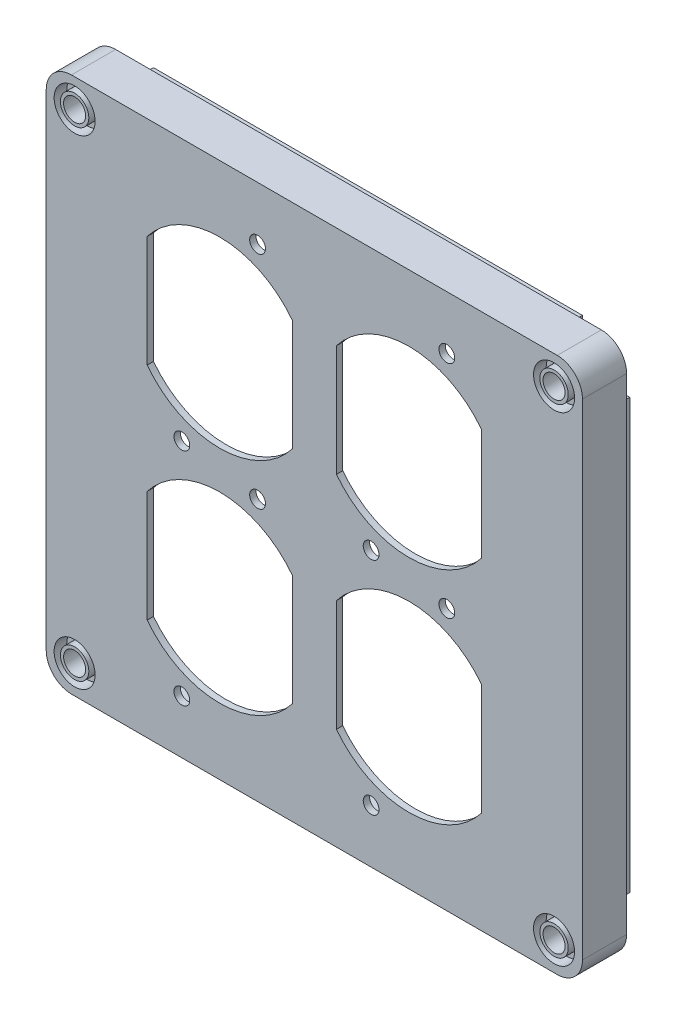
from build123d import *

# Parameters (mm, degrees)
SKETCH1_W                 = 85
SKETCH1_H                 = 85
BOSS_EXTRUDE1_DEPTH       = 7
CUT_EXTRUDE4_DEPTH        = 6
FILLET4_R                 = 4
CUT_EXTRUDE1_DEPTH        = 61.510329697
SKETCH3_R                 = 1.25
CUT_EXTRUDE6_DEPTH        = 61.510329697
LPATTERN1_COUNT           = 2
LPATTERN1_PITCH           = 35
LPATTERN1_COUNT_DIR2      = 2
LPATTERN1_PITCH_DIR2      = 30
BOSS_EXTRUDE6_DEPTH       = 7
SKETCH15_R                = 1.75
CUT_EXTRUDE7_DEPTH        = 61.510329697
SKETCH30_R                = 3.25
CUT_EXTRUDE8_DEPTH        = 2
SKETCH31_R                = 2.25
SKETCH31_R_2              = 1.75
EXTRUDE_THIN2_DEPTH       = 2
MIRROR4_COPY_1_DEPTH      = 7
MIRROR4_COPY_2_SKETCH_R   = 1.75
MIRROR4_COPY_2_DEPTH      = 61.510329697
MIRROR4_COPY_3_SKETCH_R   = 3.25
MIRROR4_COPY_3_DEPTH      = 2
MIRROR4_COPY_4_SKETCH_R   = 2.25
MIRROR4_COPY_4_SKETCH_R_2 = 1.75
MIRROR4_COPY_4_DEPTH      = 2
MOVE_FACE1_BY             = 0.5
MOVE_FACE1_2_BY           = 0.5
MOVE_FACE1_3_BY           = 0.5
MOVE_FACE1_4_BY           = 0.5
MOVE_FACE1_5_BY           = 0.5
MOVE_FACE1_6_BY           = 0.5
MOVE_FACE1_7_BY           = 0.5
MOVE_FACE1_8_BY           = 0.5
MOVE_FACE1_9_BY           = 0.5
MOVE_FACE1_10_BY          = 0.5
MOVE_FACE1_11_BY          = 0.5
MOVE_FACE1_12_BY          = 0.5
EXTRUDE_THIN1_DEPTH       = 1.5


with BuildPart() as part:
    # Sketch1 → Boss-Extrude1 (new body)
    with BuildSketch(Plane.XY):
        Rectangle(SKETCH1_W, SKETCH1_H)
    extrude(amount=BOSS_EXTRUDE1_DEPTH)

    # Sketch8 → Cut-Extrude4 (cut)
    with BuildSketch(Plane(origin=(0, 0, 0), x_dir=(-1, 0, 0), z_dir=(0, 0, -1))):
        with BuildLine():
            Line((40.5, -37.5), (40.5, 37.5))
            ThreePointArc((40.5, 37.5), (39.621320344, 39.621320344), (37.5, 40.5))
            Line((37.5, 40.5), (-37.5, 40.5))
            ThreePointArc((-37.5, 40.5), (-39.621320344, 39.621320344), (-40.5, 37.5))
            Line((-40.5, 37.5), (-40.5, -37.5))
            ThreePointArc((-40.5, -37.5), (-39.621320344, -39.621320344), (-37.5, -40.5))
            Line((-37.5, -40.5), (37.5, -40.5))
            ThreePointArc((37.5, -40.5), (39.621320344, -39.621320344), (40.5, -37.5))
        make_face()
    extrude(amount=-CUT_EXTRUDE4_DEPTH, mode=Mode.SUBTRACT)

    # Fillet4
    fillet4_edges = [part.edges().sort_by_distance(p)[0] for p in [
        (42.5, -42.5, 3.5),
        (-42.5, -42.5, 3.5),
        (-42.5, 42.5, 3.5),
        (42.5, 42.5, 3.5),
    ]]
    fillet(fillet4_edges, radius=FILLET4_R)

    # Sketch2 → Cut-Extrude1 (cut, through all)
    with BuildSketch(Plane.XY.offset(7)):
        with BuildLine():
            Line((-26.5, 8.668239134), (-26.5, 26.331760866))
            ThreePointArc((-26.5, 26.331760866), (-15, 32), (-3.5, 26.331760866))
            Line((-3.5, 26.331760866), (-3.5, 8.668239134))
            ThreePointArc((-3.5, 8.668239134), (-15, 3), (-26.5, 8.668239134))
        make_face()
    cut_extrude1 = extrude(amount=-CUT_EXTRUDE1_DEPTH, mode=Mode.SUBTRACT)

    # Sketch3 → Cut-Extrude6 (cut, through all)
    with BuildSketch(Plane.XY.offset(7)):
        with Locations((-9, 34)):
            Circle(SKETCH3_R)
        with Locations((-21, 1)):
            Circle(SKETCH3_R)
    cut_extrude6 = extrude(amount=-CUT_EXTRUDE6_DEPTH, mode=Mode.SUBTRACT)

    # LPattern1: Cut-Extrude1, Cut-Extrude6 2 × 2
    with Locations(*[(j * LPATTERN1_PITCH_DIR2, -i * LPATTERN1_PITCH, 0) for i in range(LPATTERN1_COUNT) for j in range(LPATTERN1_COUNT_DIR2) if (i, j) != (0, 0)]):
        add(cut_extrude1, mode=Mode.SUBTRACT)
        add(cut_extrude6, mode=Mode.SUBTRACT)

    # Sketch14 → Boss-Extrude6 (add)
    with BuildSketch(Plane.XY.offset(7)):
        with BuildLine():
            Line((-38, 33.5), (-42.5, 33.5))
            Line((-42.5, 33.5), (-42.5, 38))
            ThreePointArc((-42.5, 38), (-41.181980515, 41.181980515), (-38, 42.5))
            Line((-38, 42.5), (-33.5, 42.5))
            Line((-33.5, 42.5), (-33.5, 38))
            ThreePointArc((-33.5, 38), (-34.818019485, 34.818019485), (-38, 33.5))
        make_face()
    boss_extrude6 = extrude(amount=-BOSS_EXTRUDE6_DEPTH)

    # Sketch15 → Cut-Extrude7 (cut, through all)
    with BuildSketch(Plane(origin=(0, 0, 0), x_dir=(-1, 0, 0), z_dir=(0, 0, -1))):
        with Locations((38, 38)):
            Circle(SKETCH15_R)
    cut_extrude7 = extrude(amount=-CUT_EXTRUDE7_DEPTH, mode=Mode.SUBTRACT)

    # Sketch30 → Cut-Extrude8 (cut)
    with BuildSketch(Plane.XY.offset(7)):
        with Locations((-38, 38)):
            Circle(SKETCH30_R)
    cut_extrude8 = extrude(amount=-CUT_EXTRUDE8_DEPTH, mode=Mode.SUBTRACT)

    # Sketch31 → Extrude-Thin2 (add)
    with BuildSketch(Plane.XY.offset(5)):
        with Locations((-38, 38)):
            Circle(SKETCH31_R)
        with Locations((-38, 38)):
            Circle(SKETCH31_R_2, mode=Mode.SUBTRACT)
    extrude_thin2 = extrude(amount=EXTRUDE_THIN2_DEPTH)

    # Mirror3: Boss-Extrude6, Cut-Extrude7, Cut-Extrude8, Extrude-Thin2 across plane
    add(boss_extrude6.mirror(Plane(origin=(0, 0, 0), x_dir=(0, 0, 1), z_dir=(1, 0, 0))))
    add(cut_extrude7.mirror(Plane(origin=(0, 0, 0), x_dir=(0, 0, 1), z_dir=(1, 0, 0))), mode=Mode.SUBTRACT)
    add(cut_extrude8.mirror(Plane(origin=(0, 0, 0), x_dir=(0, 0, 1), z_dir=(1, 0, 0))), mode=Mode.SUBTRACT)
    add(extrude_thin2.mirror(Plane(origin=(0, 0, 0), x_dir=(0, 0, 1), z_dir=(1, 0, 0))))

    # Mirror4: Boss-Extrude6, Cut-Extrude7, Cut-Extrude8, Extrude-Thin2 across plane
    add(boss_extrude6.mirror(Plane.ZX))
    add(cut_extrude7.mirror(Plane.ZX), mode=Mode.SUBTRACT)
    add(cut_extrude8.mirror(Plane.ZX), mode=Mode.SUBTRACT)
    add(extrude_thin2.mirror(Plane.ZX))

    # Mirror4 copy 1 sketch → Mirror4 copy 1 (add)
    with BuildSketch(Plane(origin=(0, 0, 7), x_dir=(-1, 0, 0), z_dir=(0, 0, 1))):
        with BuildLine():
            Line((-38, 33.5), (-42.5, 33.5))
            Line((-42.5, 33.5), (-42.5, 38))
            ThreePointArc((-42.5, 38), (-41.181980515, 41.181980515), (-38, 42.5))
            Line((-38, 42.5), (-33.5, 42.5))
            Line((-33.5, 42.5), (-33.5, 38))
            ThreePointArc((-33.5, 38), (-34.818019485, 34.818019485), (-38, 33.5))
        make_face()
    extrude(amount=-MIRROR4_COPY_1_DEPTH)

    # Mirror4 copy 2 sketch → Mirror4 copy 2 (cut, through all)
    with BuildSketch(Plane(origin=(0, 0, 0), x_dir=(1, 0, 0), z_dir=(0, 0, -1))):
        with Locations((38, 38)):
            Circle(MIRROR4_COPY_2_SKETCH_R)
    extrude(amount=-MIRROR4_COPY_2_DEPTH, mode=Mode.SUBTRACT)

    # Mirror4 copy 3 sketch → Mirror4 copy 3 (cut)
    with BuildSketch(Plane(origin=(0, 0, 7), x_dir=(-1, 0, 0), z_dir=(0, 0, 1))):
        with Locations((-38, 38)):
            Circle(MIRROR4_COPY_3_SKETCH_R)
    extrude(amount=-MIRROR4_COPY_3_DEPTH, mode=Mode.SUBTRACT)

    # Mirror4 copy 4 sketch → Mirror4 copy 4 (add)
    with BuildSketch(Plane(origin=(0, 0, 5), x_dir=(-1, 0, 0), z_dir=(0, 0, 1))):
        with Locations((-38, 38)):
            Circle(MIRROR4_COPY_4_SKETCH_R)
        with Locations((-38, 38)):
            Circle(MIRROR4_COPY_4_SKETCH_R_2, mode=Mode.SUBTRACT)
    extrude(amount=MIRROR4_COPY_4_DEPTH)

    # Move Face1: a curved face moved outward by 0.5
    add(Solid.thicken(part.faces().sort_by_distance((-34.818019485, -34.818019485, 3))[0], MOVE_FACE1_BY))

    # Move Face1 2: a face moved outward by 0.5
    extrude(part.faces().sort_by_distance((-33.5, -39.25, 3))[0], amount=MOVE_FACE1_2_BY, dir=(1, 0, 0))

    # Move Face1 3: a face moved outward by 0.5
    extrude(part.faces().sort_by_distance((-39.25, -33.5, 3))[0], amount=MOVE_FACE1_3_BY, dir=(0, 1, 0))

    # Move Face1 4: a face moved outward by 0.5
    extrude(part.faces().sort_by_distance((33.5, -39.25, 3))[0], amount=MOVE_FACE1_4_BY, dir=(-1, 0, 0))

    # Move Face1 5: a face moved outward by 0.5
    extrude(part.faces().sort_by_distance((39.25, -33.5, 3))[0], amount=MOVE_FACE1_5_BY, dir=(0, 1, 0))

    # Move Face1 6: a curved face moved outward by 0.5
    add(Solid.thicken(part.faces().sort_by_distance((34.818019485, -34.818019485, 3))[0], MOVE_FACE1_6_BY))

    # Move Face1 7: a face moved outward by 0.5
    extrude(part.faces().sort_by_distance((33.5, 39.25, 3))[0], amount=MOVE_FACE1_7_BY, dir=(-1, 0, 0))

    # Move Face1 8: a curved face moved outward by 0.5
    add(Solid.thicken(part.faces().sort_by_distance((34.818019485, 34.818019485, 3))[0], MOVE_FACE1_8_BY))

    # Move Face1 9: a face moved outward by 0.5
    extrude(part.faces().sort_by_distance((39.25, 33.5, 3))[0], amount=MOVE_FACE1_9_BY, dir=(0, -1, 0))

    # Move Face1 10: a face moved outward by 0.5
    extrude(part.faces().sort_by_distance((-39.25, 33.5, 3))[0], amount=MOVE_FACE1_10_BY, dir=(0, -1, 0))

    # Move Face1 11: a curved face moved outward by 0.5
    add(Solid.thicken(part.faces().sort_by_distance((-34.818019485, 34.818019485, 3))[0], MOVE_FACE1_11_BY))

    # Move Face1 12: a face moved outward by 0.5
    extrude(part.faces().sort_by_distance((-33.5, 39.25, 3))[0], amount=MOVE_FACE1_12_BY, dir=(1, 0, 0))

    # Sketch29 → Extrude-Thin1 (add)
    with BuildSketch(Plane(origin=(0, 0, 0), x_dir=(-1, 0, 0), z_dir=(0, 0, -1))):
        with BuildLine():
            Line((34, 38), (34, 41.5))
            Line((34, 41.5), (-34, 41.5))
            Line((-34, 41.5), (-34, 38))
            ThreePointArc((-34, 38), (-35.171572875, 35.171572875), (-38, 34))
            Line((-38, 34), (-41.5, 34))
            Line((-41.5, 34), (-41.5, -34))
            Line((-41.5, -34), (-38, -34))
            ThreePointArc((-38, -34), (-35.171572875, -35.171572875), (-34, -38))
            Line((-34, -38), (-34, -41.5))
            Line((-34, -41.5), (34, -41.5))
            Line((34, -41.5), (34, -38))
            ThreePointArc((34, -38), (35.171572875, -35.171572875), (38, -34))
            Line((38, -34), (41.5, -34))
            Line((41.5, -34), (41.5, 34))
            Line((41.5, 34), (38, 34))
            ThreePointArc((38, 34), (35.171572875, 35.171572875), (34, 38))
        make_face()
        with BuildLine():
            Line((33, 38), (33, 40.5))
            Line((33, 40.5), (-33, 40.5))
            Line((-33, 40.5), (-33, 38))
            ThreePointArc((-33, 38), (-34.464466094, 34.464466094), (-38, 33))
            Line((-38, 33), (-40.5, 33))
            Line((-40.5, 33), (-40.5, -33))
            Line((-40.5, -33), (-38, -33))
            ThreePointArc((-38, -33), (-34.464466094, -34.464466094), (-33, -38))
            Line((-33, -38), (-33, -40.5))
            Line((-33, -40.5), (33, -40.5))
            Line((33, -40.5), (33, -38))
            ThreePointArc((33, -38), (34.464466094, -34.464466094), (38, -33))
            Line((38, -33), (40.5, -33))
            Line((40.5, -33), (40.5, 33))
            Line((40.5, 33), (38, 33))
            ThreePointArc((38, 33), (34.464466094, 34.464466094), (33, 38))
        make_face(mode=Mode.SUBTRACT)
    extrude(amount=EXTRUDE_THIN1_DEPTH)


solid = part.part
